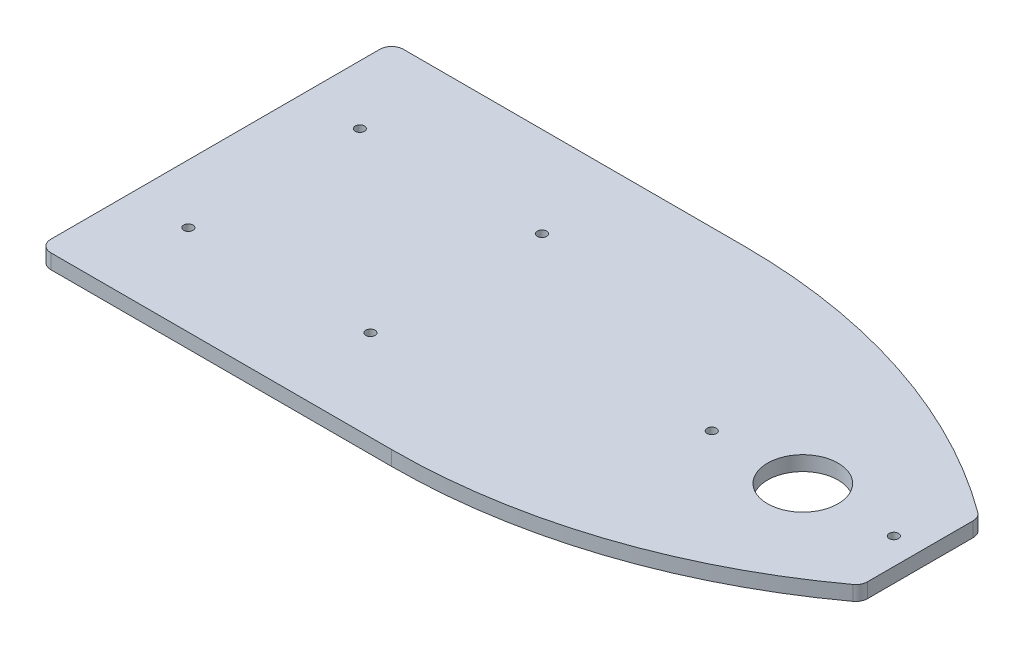
from build123d import *

# Parameters (mm, degrees)
SKETCH1_W           = 152.4
SKETCH1_H           = 76.2
BOSS_EXTRUDE1_DEPTH = 3.175
CUT_EXTRUDE1_DEPTH  = 3.175
FILLET2_R           = 2.54
FILLET3_R           = 2.54
SKETCH5_R           = 7.62
CUT_EXTRUDE2_DEPTH  = 3.175
SKETCH7_R           = 1.0033
CUT_EXTRUDE4_DEPTH  = 86.253332046
SKETCH6_R           = 1.0033
CUT_EXTRUDE5_DEPTH  = 86.253332046


with BuildPart() as part:
    # Sketch1 → Boss-Extrude1 (new body)
    with BuildSketch(Plane(origin=(0, 0, 0), x_dir=(1, 0, 0), z_dir=(0, 1, 0))):
        Rectangle(SKETCH1_W, SKETCH1_H)
    extrude(amount=BOSS_EXTRUDE1_DEPTH)

    # Sketch4 → Cut-Extrude1 (cut)
    with BuildSketch(Plane(origin=(0, 3.175, 0), x_dir=(1, 0, 0), z_dir=(0, 1, 0))):
        with BuildLine():
            Line((0, 38.1), (76.2, 38.1))
            Line((76.2, 38.1), (76.2, 12.7))
            ThreePointArc((76.2, 12.7), (40.160926284, 31.582778852), (0, 38.1))
        make_face()
        with BuildLine():
            Line((76.2, -38.1), (76.2, -12.7))
            ThreePointArc((76.2, -12.7), (40.160926284, -31.582778852), (0, -38.1))
            Line((0, -38.1), (76.2, -38.1))
        make_face()
    extrude(amount=-CUT_EXTRUDE1_DEPTH, mode=Mode.SUBTRACT)

    # Fillet2
    fillet2_edges = [part.edges().sort_by_distance(p)[0] for p in [
        (76.2, 1.5875, -12.7),
        (76.2, 1.5875, 12.7),
    ]]
    fillet(fillet2_edges, radius=FILLET2_R)

    # Fillet3
    fillet3_edges = [part.edges().sort_by_distance(p)[0] for p in [
        (-76.2, 1.5875, -38.1),
        (-76.2, 1.5875, 38.1),
    ]]
    fillet(fillet3_edges, radius=FILLET3_R)

    # Sketch5 → Cut-Extrude2 (cut)
    with BuildSketch(Plane(origin=(0, 3.175, 0), x_dir=(1, 0, 0), z_dir=(0, 1, 0))):
        with Locations(Location((50.8, 0, 0), (0, 0, 270))):
            Circle(SKETCH5_R)
    extrude(amount=-CUT_EXTRUDE2_DEPTH, mode=Mode.SUBTRACT)

    # Sketch7 → Cut-Extrude4 (cut, through all)
    with BuildSketch(Plane(origin=(0, 3.175, 0), x_dir=(1, 0, 0), z_dir=(0, 1, 0))):
        with Locations(Location((70.485, 0, 0), (0, 0, 270))):
            Circle(SKETCH7_R)
        with Locations(Location((31.115, 0, 0), (0, 0, 270))):
            Circle(SKETCH7_R)
    extrude(amount=-CUT_EXTRUDE4_DEPTH, mode=Mode.SUBTRACT)

    # Sketch6 → Cut-Extrude5 (cut, through all)
    with BuildSketch(Plane(origin=(0, 3.175, 0), x_dir=(1, 0, 0), z_dir=(0, 1, 0))):
        with Locations(Location((-63.5, 18.542, 0), (0, 0, 270))):
            Circle(SKETCH6_R)
        with Locations(Location((-24.13, 18.542, 0), (0, 0, 270))):
            Circle(SKETCH6_R)
        with Locations(Location((-24.13, -18.542, 0), (0, 0, 270))):
            Circle(SKETCH6_R)
        with Locations(Location((-63.5, -18.542, 0), (0, 0, 270))):
            Circle(SKETCH6_R)
    extrude(amount=-CUT_EXTRUDE5_DEPTH, mode=Mode.SUBTRACT)


solid = part.part
